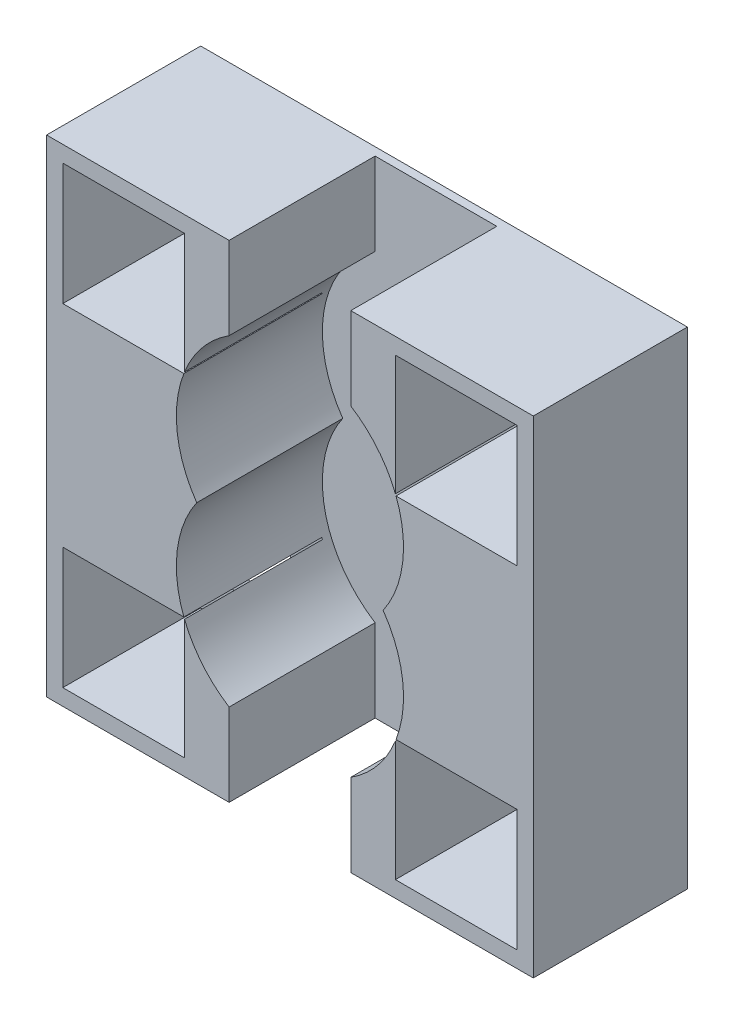
from build123d import *

# Parameters (mm, degrees)
ESBO_O1_W                = 60
ESBO_O1_H                = 60
RESSALTO_EXTRUS_O2_DEPTH = 1
ESBO_O10_W               = 60
ESBO_O10_H               = 60
RESSALTO_EXTRUS_O5_DEPTH = 19
ESBO_O13_W               = 15
ESBO_O13_H               = 15
CORTE_EXTRUS_O7_DEPTH    = 17
ESBO_O14_R               = 5
CORTE_EXTRUS_O8_DEPTH    = 86.775773693
CORTE_EXTRUS_O9_START    = -18
ESBO_O15_R               = 4.5
CORTE_EXTRUS_O9_DEPTH    = 18


with BuildPart() as part:
    # Esboço1 → Ressalto-extrusão2 (new body)
    with BuildSketch(Plane.XY):
        with Locations((29.870134555, 28.412758376)):
            Rectangle(ESBO_O1_W, ESBO_O1_H)
    extrude(amount=RESSALTO_EXTRUS_O2_DEPTH)

    # Esboço10 → Ressalto-extrusão5 (add)
    with BuildSketch(Plane.XY):
        with Locations((29.870134555, 28.412758376)):
            Rectangle(ESBO_O10_W, ESBO_O10_H)
        with BuildLine():
            ThreePointArc((18.381009261, 28.412758376), (29.870134555, 6.412758376), (41.359259848, 28.412758376))
            ThreePointArc((41.359259848, 28.412758376), (29.870134555, 50.412758376), (18.381009261, 28.412758376))
        make_face(mode=Mode.SUBTRACT)
    extrude(amount=RESSALTO_EXTRUS_O5_DEPTH)

    # Esboço13 → Corte-extrusão7 (cut)
    with BuildSketch(Plane.XY.offset(19)):
        with Locations((9.370134555, 48.912758376)):
            Rectangle(ESBO_O13_W, ESBO_O13_H)
        with Locations((50.370134555, 48.912758376)):
            Rectangle(ESBO_O13_W, ESBO_O13_H)
        with Locations((9.370134555, 7.912758376)):
            Rectangle(ESBO_O13_W, ESBO_O13_H)
        with Locations((50.370134555, 7.912758376)):
            Rectangle(ESBO_O13_W, ESBO_O13_H)
    extrude(amount=-CORTE_EXTRUS_O7_DEPTH, mode=Mode.SUBTRACT)

    # Esboço14 → Corte-extrusão8 (cut, through all)
    with BuildSketch(Plane.XY.offset(19)):
        with Locations((9.370134555, 48.912758376)):
            Circle(ESBO_O14_R)
        with Locations((9.370134555, 7.912758376)):
            Circle(ESBO_O14_R)
        with Locations((50.370134555, 7.912758376)):
            Circle(ESBO_O14_R)
        with Locations((50.370134555, 48.912758376)):
            Circle(ESBO_O14_R)
    extrude(amount=-CORTE_EXTRUS_O8_DEPTH, mode=Mode.SUBTRACT)

    # Esboço15 → Corte-extrusão9 (cut)
    with BuildSketch(Plane.XY.offset(19).offset(CORTE_EXTRUS_O9_START)):
        with Locations((29.870134555, 28.412758376)):
            Circle(ESBO_O15_R)
        with BuildLine():
            Line((22.370134555, 8.591167958), (22.370134555, -1.587241624))
            Line((22.370134555, -1.587241624), (37.370134555, -1.587241624))
            Line((37.370134555, -1.587241624), (37.370134555, 8.591167958))
            ThreePointArc((37.370134555, 8.591167958), (29.870134555, 6.412758376), (22.370134555, 8.591167958))
        make_face()
        with BuildLine():
            Line((22.370134555, 58.412758376), (37.370134555, 58.412758376))
            Line((37.370134555, 58.412758376), (37.370134555, 48.234348794))
            ThreePointArc((37.370134555, 48.234348794), (29.870134555, 50.412758376), (22.370134555, 48.234348794))
            Line((22.370134555, 48.234348794), (22.370134555, 58.412758376))
        make_face()
    extrude(amount=CORTE_EXTRUS_O9_DEPTH, mode=Mode.SUBTRACT)


solid = part.part
